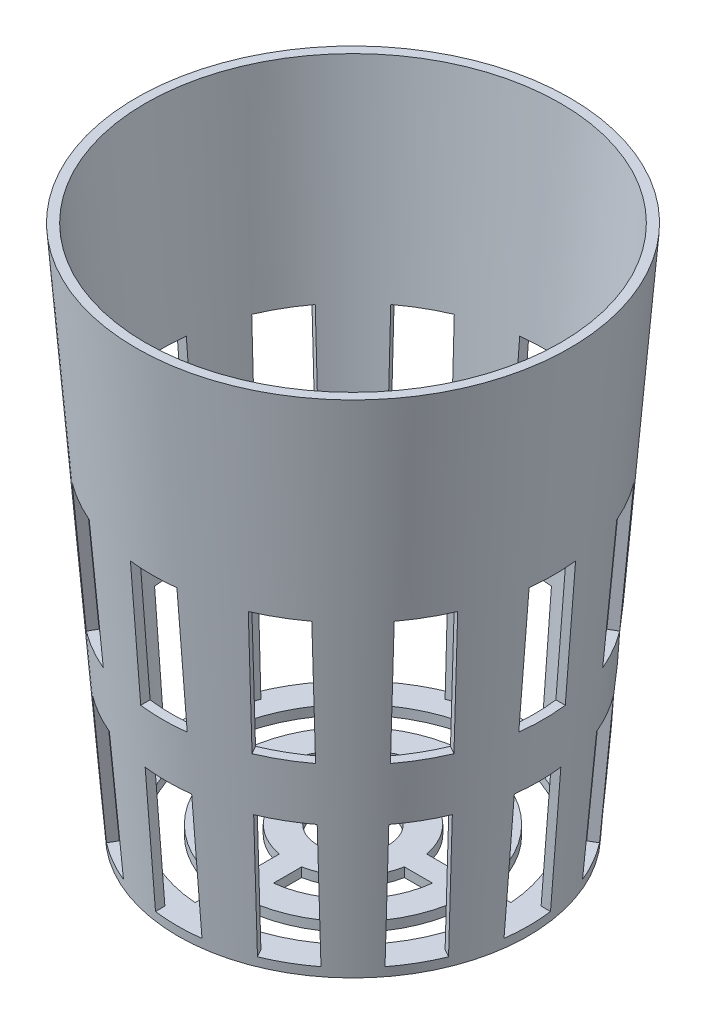
from build123d import *

# Parameters (mm, degrees)
SKETCH1_R           = 18.825
BOSS_EXTRUDE1_DEPTH = 57
BOSS_EXTRUDE1_DRAFT = -4.5
SHELL1_T            = -1
SKETCH4_R           = 3.825
CUT_EXTRUDE1_DEPTH  = 57
SKETCH5_W           = 5
SKETCH5_H           = 14
CUT_EXTRUDE2_DEPTH  = 66.846831277
CIRPATTERN1_COUNT   = 12


with BuildPart() as part:
    # Sketch1 → Boss-Extrude1 (with draft: the straight prism first)
    with BuildSketch(Plane(origin=(0, 0, 0), x_dir=(1, 0, 0), z_dir=(0, 1, 0))):
        Circle(SKETCH1_R)
    extrude(amount=BOSS_EXTRUDE1_DEPTH)
    # Boss-Extrude1: the draft: its side faces are tilted about the plane it starts from
    boss_extrude1_sides = [part.faces().sort_by_distance(p)[0] for p in [
        (-18.825, 28.5, 0),
    ]]
    draft(boss_extrude1_sides, Plane(origin=(0, 0, 0), x_dir=(1, 0, 0), z_dir=(0, 1, 0)), BOSS_EXTRUDE1_DRAFT)

    # Shell1
    shell1_openings = [part.faces().sort_by_distance(p)[0] for p in [
        (0, 57, 0),
    ]]
    offset(amount=SHELL1_T, openings=shell1_openings, kind=Kind.INTERSECTION)

    # Sketch4 → Cut-Extrude1 (cut)
    with BuildSketch(Plane.XZ):
        Circle(SKETCH4_R)
        with BuildLine():
            Line((9.751442201, -1.2), (6.718677325, -1.2))
            ThreePointArc((6.718677325, -1.2), (4.826003782, -4.826003782), (1.2, -6.718677325))
            Line((1.2, -6.718677325), (1.2, -9.751442201))
            ThreePointArc((1.2, -9.751442201), (6.947324125, -6.947324125), (9.751442201, -1.2))
        make_face()
        with BuildLine():
            Line((15.779436777, -1.2), (12.768736233, -1.2))
            ThreePointArc((12.768736233, -1.2), (9.068644469, -9.068644469), (1.2, -12.768736233))
            Line((1.2, -12.768736233), (1.2, -15.779436777))
            ThreePointArc((1.2, -15.779436777), (11.189964812, -11.189964812), (15.779436777, -1.2))
        make_face()
        with BuildLine():
            Line((-1.2, -9.751442201), (-1.2, -6.718677325))
            ThreePointArc((-1.2, -6.718677325), (-4.826003782, -4.826003782), (-6.718677325, -1.2))
            Line((-6.718677325, -1.2), (-9.751442201, -1.2))
            ThreePointArc((-9.751442201, -1.2), (-6.947324125, -6.947324125), (-1.2, -9.751442201))
        make_face()
        with BuildLine():
            ThreePointArc((1.2, 6.718677325), (4.826003782, 4.826003782), (6.718677325, 1.2))
            Line((6.718677325, 1.2), (9.751442201, 1.2))
            ThreePointArc((9.751442201, 1.2), (6.947324125, 6.947324125), (1.2, 9.751442201))
            Line((1.2, 9.751442201), (1.2, 6.718677325))
        make_face()
        with BuildLine():
            Line((-1.2, -15.779436777), (-1.2, -12.768736233))
            ThreePointArc((-1.2, -12.768736233), (-9.068644469, -9.068644469), (-12.768736233, -1.2))
            Line((-12.768736233, -1.2), (-15.779436777, -1.2))
            ThreePointArc((-15.779436777, -1.2), (-11.189964812, -11.189964812), (-1.2, -15.779436777))
        make_face()
        with BuildLine():
            ThreePointArc((1.2, 12.768736233), (9.068644469, 9.068644469), (12.768736233, 1.2))
            Line((12.768736233, 1.2), (15.779436777, 1.2))
            ThreePointArc((15.779436777, 1.2), (11.189964812, 11.189964812), (1.2, 15.779436777))
            Line((1.2, 15.779436777), (1.2, 12.768736233))
        make_face()
        with BuildLine():
            Line((-9.751442201, 1.2), (-6.718677325, 1.2))
            ThreePointArc((-6.718677325, 1.2), (-4.826003782, 4.826003782), (-1.2, 6.718677325))
            Line((-1.2, 6.718677325), (-1.2, 9.751442201))
            ThreePointArc((-1.2, 9.751442201), (-6.947324125, 6.947324125), (-9.751442201, 1.2))
        make_face()
        with BuildLine():
            Line((-15.779436777, 1.2), (-12.768736233, 1.2))
            ThreePointArc((-12.768736233, 1.2), (-9.068644469, 9.068644469), (-1.2, 12.768736233))
            Line((-1.2, 12.768736233), (-1.2, 15.779436777))
            ThreePointArc((-1.2, 15.779436777), (-11.189964812, 11.189964812), (-15.779436777, 1.2))
        make_face()
    extrude(amount=-CUT_EXTRUDE1_DEPTH, mode=Mode.SUBTRACT)

    # Sketch5 → Cut-Extrude2 (cut, through all)
    with BuildSketch(Plane.XY):
        with Locations((0, 8)):
            Rectangle(SKETCH5_W, SKETCH5_H)
        with Locations((0, 28)):
            Rectangle(SKETCH5_W, SKETCH5_H)
    cut_extrude2 = extrude(amount=-CUT_EXTRUDE2_DEPTH, mode=Mode.SUBTRACT)

    # CirPattern1: Cut-Extrude2 ×12 about axis
    cirpattern1_axis = Axis((0, 0, 0), (0, -1, 0))
    for i in range(1, CIRPATTERN1_COUNT):
        add(cut_extrude2.rotate(cirpattern1_axis, i * 360 / CIRPATTERN1_COUNT), mode=Mode.SUBTRACT)


solid = part.part
